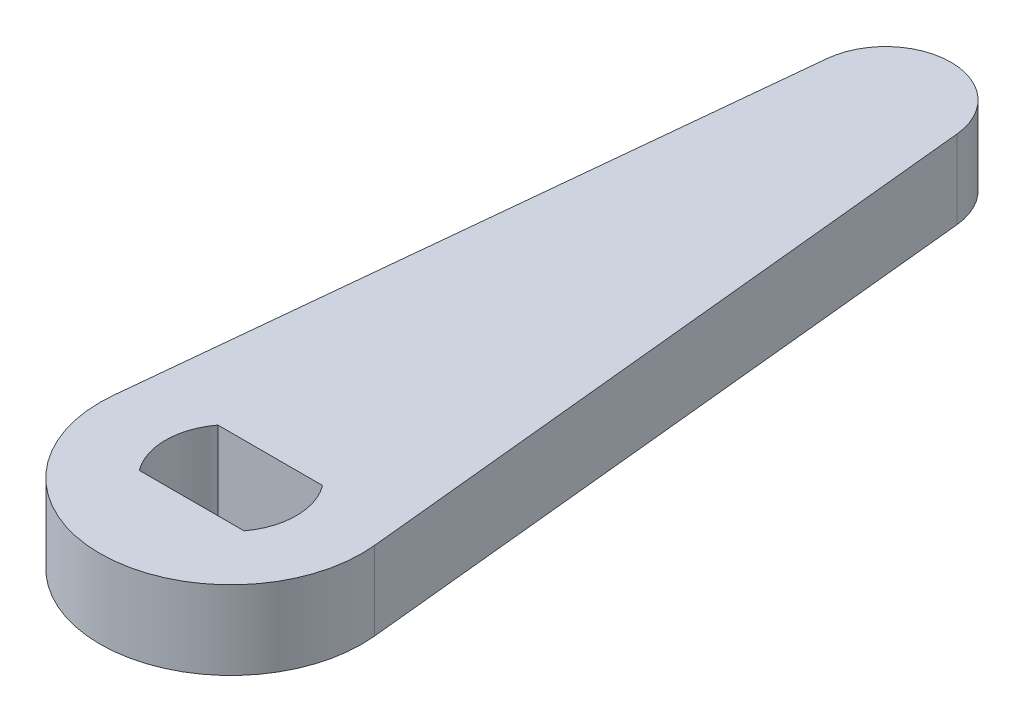
from build123d import *

# Parameters (mm, degrees)
BOSS_EXTRUDE1_DEPTH = 3


with BuildPart() as part:
    # Sketch1 → Boss-Extrude1 (new body)
    with BuildSketch(Plane(origin=(0, 0, 0), x_dir=(1, 0, 0), z_dir=(0, 1, 0))):
        with BuildLine():
            Line((-4.974937186, 0.5), (-2.487468593, 25.25))
            ThreePointArc((-2.487468593, 25.25), (0, 27.5), (2.487468593, 25.25))
            Line((2.487468593, 25.25), (4.974937186, 0.5))
            ThreePointArc((4.974937186, 0.5), (0, -5), (-4.974937186, 0.5))
        make_face()
        with BuildLine():
            Line((-2, -1.5), (2, -1.5))
            ThreePointArc((2, -1.5), (2.5, 0), (2, 1.5))
            Line((2, 1.5), (-2, 1.5))
            ThreePointArc((-2, 1.5), (-2.5, 0), (-2, -1.5))
        make_face(mode=Mode.SUBTRACT)
    extrude(amount=BOSS_EXTRUDE1_DEPTH)


solid = part.part
